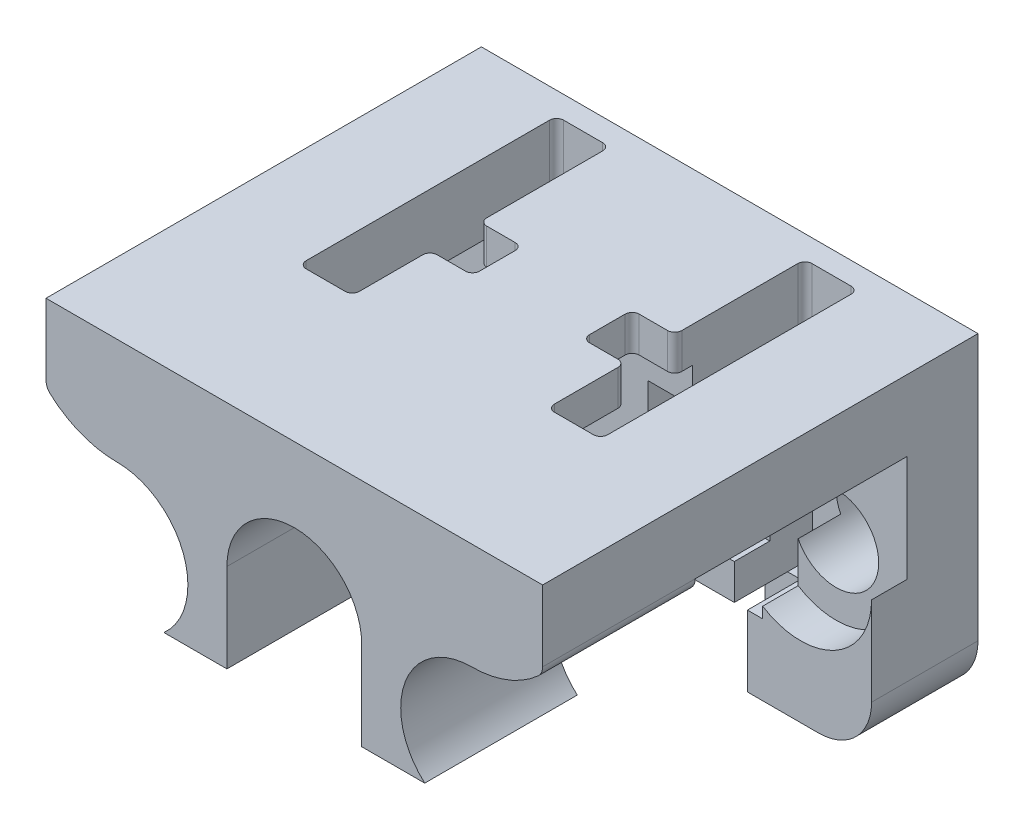
from build123d import *

# Parameters (mm, degrees)
SKETCH1_W            = 14
SKETCH1_H            = 7
BOSS_EXTRUDE1_DEPTH  = 2
FILLET1_R            = 1.5
M2_CLEARANCE_HOLE1_D = 2.4
SKETCH4_W            = 14
SKETCH4_H            = 12.27377735
BOSS_EXTRUDE2_DEPTH  = 2
BOSS_EXTRUDE3_START  = 1
BOSS_EXTRUDE3_DEPTH  = 1
SKETCH6_W            = 5
SKETCH6_H            = 3.5
CUT_EXTRUDE1_DEPTH   = 1.5
CUT_EXTRUDE2_REACH   = 15.976
SKETCH7_W            = 7
SKETCH7_H            = 2
SKETCH8_W            = 3
SKETCH8_H            = 4
SKETCH8_H_2          = 1
BOSS_EXTRUDE4_DEPTH  = 1.8
CUT_EXTRUDE3_DEPTH   = 2
SKETCH10_W           = 8.1
SKETCH10_H           = 4.09
CUT_EXTRUDE4_DEPTH   = 1
BOSS_EXTRUDE5_DEPTH  = 4.3
SKETCH13_W           = 0.8
SKETCH13_H           = 2.2
CUT_EXTRUDE5_DEPTH   = 5


with BuildPart() as part:
    # Sketch1 → Boss-Extrude1 (new body)
    with BuildSketch(Plane.XY):
        Rectangle(SKETCH1_W, SKETCH1_H)
    extrude(amount=BOSS_EXTRUDE1_DEPTH)

    # Fillet1
    fillet1_edges = [part.edges().sort_by_distance(p)[0] for p in [
        (7, -3.5, 1),
        (-7, -3.5, 1),
    ]]
    fillet(fillet1_edges, radius=FILLET1_R)

    # M2 Clearance Hole1 (through all)
    with Locations(Plane.XY.offset(2)):
        with Locations((-5, 0.5), (5, 0.5)):
            Hole(M2_CLEARANCE_HOLE1_D / 2)

    # Sketch4 → Boss-Extrude2 (add)
    with BuildSketch(Plane(origin=(0, 3.5, 0), x_dir=(1, 0, 0), z_dir=(0, 1, 0))):
        with Locations((0, -6.136888675)):
            Rectangle(SKETCH4_W, SKETCH4_H)
    extrude(amount=BOSS_EXTRUDE2_DEPTH)

    # Sketch5 → Boss-Extrude3 (add)
    with BuildSketch(Plane.XY.offset(2).offset(BOSS_EXTRUDE3_START)):
        with BuildLine():
            ThreePointArc((-7, -2), (-6.560660172, -3.060660172), (-5.5, -3.5))
            Line((-5.5, -3.5), (5.5, -3.5))
            ThreePointArc((5.5, -3.5), (6.560660172, -3.060660172), (7, -2))
            Line((7, -2), (7, 0.5))
            ThreePointArc((7, 0.5), (5.51763809, -1.431851653), (3.267949192, -0.5))
            Line((3.267949192, -0.5), (-3.267949192, -0.5))
            ThreePointArc((-3.267949192, -0.5), (-5.51763809, -1.431851653), (-7, 0.5))
            Line((-7, 0.5), (-7, -2))
        make_face()
    extrude(amount=-BOSS_EXTRUDE3_DEPTH)

    # Sketch6 → Cut-Extrude1 (cut)
    with BuildSketch(Plane(origin=(0, 0, 0), x_dir=(-1, 0, 0), z_dir=(0, 0, -1))):
        with Locations((0, -1.75)):
            Rectangle(SKETCH6_W, SKETCH6_H)
    extrude(amount=-CUT_EXTRUDE1_DEPTH, mode=Mode.SUBTRACT)

    # Sketch7 → Cut-Extrude2 (cut, up to next)
    with BuildSketch(Plane(origin=(0, 0, 1.5), x_dir=(-1, 0, 0), z_dir=(0, 0, -1)), mode=Mode.PRIVATE) as cut_extrude2_sk1:
        with Locations((0, -2.5)):
            Rectangle(SKETCH7_W, SKETCH7_H)
    cut_extrude2_tool1 = extrude(cut_extrude2_sk1.sketch, amount=-CUT_EXTRUDE2_REACH, mode=Mode.PRIVATE) & part.part
    add(cut_extrude2_tool1.solids().sort_by_distance((0, -2.5, 1.5))[0], mode=Mode.SUBTRACT)

    # Sketch8 → Boss-Extrude4 (add)
    with BuildSketch(Plane.XY.offset(2)):
        with Locations((0, 1.5)):
            Rectangle(SKETCH8_W, SKETCH8_H)
        with Locations((0, -1)):
            Rectangle(SKETCH8_W, SKETCH8_H_2)
    extrude(amount=BOSS_EXTRUDE4_DEPTH)

    # Sketch9 → Cut-Extrude3 (cut)
    with BuildSketch(Plane(origin=(0, 5.5, 0), x_dir=(1, 0, 0), z_dir=(0, 1, 0))):
        with BuildLine():
            Line((-2.95, -7.89), (-4.05, -7.89))
            ThreePointArc((-4.05, -7.89), (-4.191421356, -7.831421356), (-4.25, -7.69))
            Line((-4.25, -7.69), (-4.25, -0.83))
            ThreePointArc((-4.25, -0.83), (-4.191421356, -0.688578644), (-4.05, -0.63))
            Line((-4.05, -0.63), (-2.95, -0.63))
            ThreePointArc((-2.95, -0.63), (-2.808578644, -0.688578644), (-2.75, -0.83))
            Line((-2.75, -0.83), (-2.75, -4.1))
            ThreePointArc((-2.75, -4.1), (-2.691421356, -4.241421356), (-2.55, -4.3))
            Line((-2.55, -4.3), (-1.75, -4.3))
            ThreePointArc((-1.75, -4.3), (-1.608578644, -4.358578644), (-1.55, -4.5))
            Line((-1.55, -4.5), (-1.55, -5.5))
            ThreePointArc((-1.55, -5.5), (-1.608578644, -5.641421356), (-1.75, -5.7))
            Line((-1.75, -5.7), (-2.55, -5.7))
            ThreePointArc((-2.55, -5.7), (-2.691421356, -5.758578644), (-2.75, -5.9))
            Line((-2.75, -5.9), (-2.75, -7.69))
            ThreePointArc((-2.75, -7.69), (-2.808578644, -7.831421356), (-2.95, -7.89))
        make_face()
        with BuildLine():
            Line((2.75, -4.1), (2.75, -0.83))
            ThreePointArc((2.75, -0.83), (2.808578644, -0.688578644), (2.95, -0.63))
            Line((2.95, -0.63), (4.05, -0.63))
            ThreePointArc((4.05, -0.63), (4.191421356, -0.688578644), (4.25, -0.83))
            Line((4.25, -0.83), (4.25, -7.69))
            ThreePointArc((4.25, -7.69), (4.191421356, -7.831421356), (4.05, -7.89))
            Line((4.05, -7.89), (2.95, -7.89))
            ThreePointArc((2.95, -7.89), (2.808578644, -7.831421356), (2.75, -7.69))
            Line((2.75, -7.69), (2.75, -5.9))
            ThreePointArc((2.75, -5.9), (2.691421356, -5.758578644), (2.55, -5.7))
            Line((2.55, -5.7), (1.75, -5.7))
            ThreePointArc((1.75, -5.7), (1.608578644, -5.641421356), (1.55, -5.5))
            Line((1.55, -5.5), (1.55, -4.5))
            ThreePointArc((1.55, -4.5), (1.608578644, -4.358578644), (1.75, -4.3))
            Line((1.75, -4.3), (2.55, -4.3))
            ThreePointArc((2.55, -4.3), (2.691421356, -4.241421356), (2.75, -4.1))
        make_face()
    extrude(amount=-CUT_EXTRUDE3_DEPTH, mode=Mode.SUBTRACT)

    # Sketch10 → Cut-Extrude4 (cut)
    with BuildSketch(Plane.XZ.offset(-3.5)):
        with Locations((0, 5.845)):
            Rectangle(SKETCH10_W, SKETCH10_H)
    extrude(amount=-CUT_EXTRUDE4_DEPTH, mode=Mode.SUBTRACT)

    # Sketch12 → Boss-Extrude5 (add)
    with BuildSketch(Plane.XY.offset(12.27377735)):
        with BuildLine():
            Line((7, 3.5), (-7, 3.5))
            ThreePointArc((-7, 3.5), (-6.966992395, 3.345092681), (-6.873703802, 3.217096517))
            ThreePointArc((-6.873703802, 3.217096517), (-6.003119304, 2.685397947), (-5, 2.5))
            ThreePointArc((-5, 2.5), (-3.585786438, 1.914213562), (-3, 0.5))
            ThreePointArc((-3, 0.5), (-3.177124344, -0.322875656), (-3.677124344, -1))
            Line((-3.677124344, -1), (-1.9, -1))
            Line((-1.9, -1), (-1.9, 1.5))
            ThreePointArc((-1.9, 1.5), (0, 3.4), (1.9, 1.5))
            Line((1.9, 1.5), (1.9, -1))
            Line((1.9, -1), (3.677124344, -1))
            ThreePointArc((3.677124344, -1), (3.129171307, 1.207106781), (5, 2.5))
            ThreePointArc((5, 2.5), (6.003119304, 2.685397947), (6.873703802, 3.217096517))
            ThreePointArc((6.873703802, 3.217096517), (6.966992395, 3.345092681), (7, 3.5))
        make_face()
    extrude(amount=-BOSS_EXTRUDE5_DEPTH)

    # Sketch13 → Cut-Extrude5 (cut)
    with BuildSketch(Plane(origin=(0, 3.5, 0), x_dir=(1, 0, 0), z_dir=(0, 1, 0))):
        with Locations((3.53, -1.9)):
            Rectangle(SKETCH13_W, SKETCH13_H)
    cut_extrude5 = extrude(amount=-CUT_EXTRUDE5_DEPTH, mode=Mode.SUBTRACT)

    # Mirror1: Cut-Extrude5 across plane
    add(cut_extrude5.mirror(Plane(origin=(0, 0, 0), x_dir=(0, 0, 1), z_dir=(1, 0, 0))), mode=Mode.SUBTRACT)


solid = part.part
